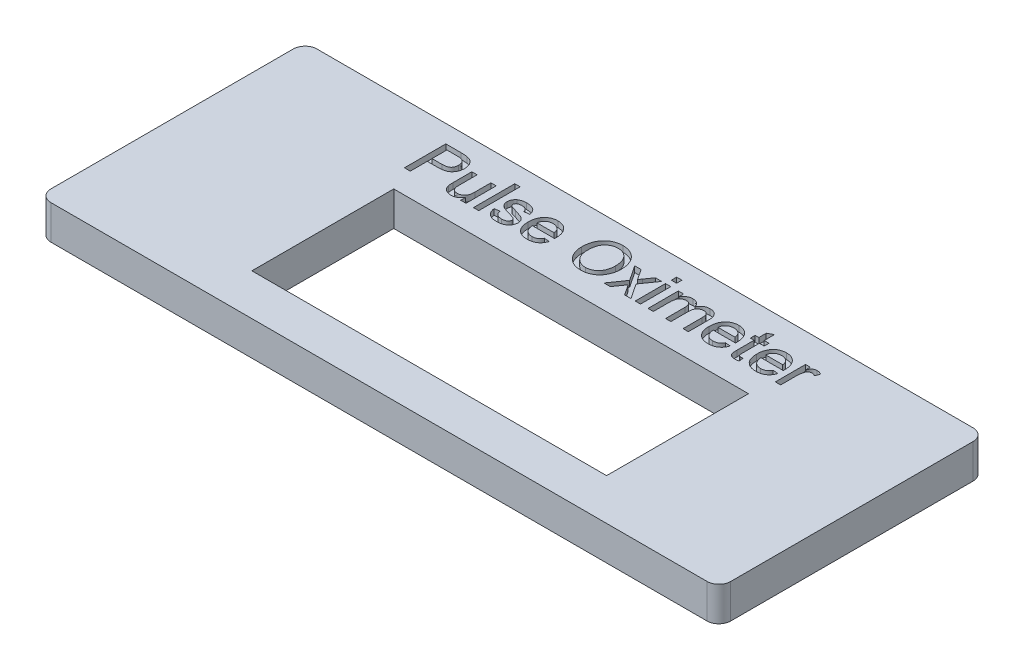
from build123d import *

# Parameters (mm, degrees)
BOSS_EXTRUDE1_DEPTH = 2.9
SKETCH2_W           = 30
SKETCH2_H           = 12
CUT_EXTRUDE1_DEPTH  = 10
SKETCH3_W           = 0.448717949
SKETCH3_H           = 3.5
SKETCH3_H_2         = 0.448717949
SKETCH3_H_3         = 2.557692308
CUT_EXTRUDE2_DEPTH  = 0.5


with BuildPart() as part:
    # Sketch1 → Boss-Extrude1 (new body)
    with BuildSketch(Plane(origin=(0, 0, 0), x_dir=(1, 0, 0), z_dir=(0, 1, 0))):
        with BuildLine():
            Line((1, 0), (56.5, 0))
            ThreePointArc((56.5, 0), (57.207106781, 0.292893219), (57.5, 1))
            Line((57.5, 1), (57.5, 21.5))
            ThreePointArc((57.5, 21.5), (57.207106781, 22.207106781), (56.5, 22.5))
            Line((56.5, 22.5), (1, 22.5))
            ThreePointArc((1, 22.5), (0.292893219, 22.207106781), (0, 21.5))
            Line((0, 21.5), (0, 1))
            ThreePointArc((0, 1), (0.292893219, 0.292893219), (1, 0))
        make_face()
    extrude(amount=BOSS_EXTRUDE1_DEPTH)

    # Sketch2 → Cut-Extrude1 (cut)
    with BuildSketch(Plane(origin=(0, 3, 0), x_dir=(1, 0, 0), z_dir=(0, 1, 0))):
        with Locations((29.5, 9.5)):
            Rectangle(SKETCH2_W, SKETCH2_H)
    extrude(amount=-CUT_EXTRUDE1_DEPTH, mode=Mode.SUBTRACT)

    # Sketch3 → Cut-Extrude2 (cut)
    # profile 1 of 14: a face of its own
    with BuildSketch(Plane(origin=(0, 2.9, 0), x_dir=(1, 0, 0), z_dir=(0, 1, 0))):
        with BuildLine():
            Line((13.403846154, 17.5), (13.403846154, 21))
            Line((13.403846154, 21), (14.689703526, 21))
            add(Edge.make_bspline(
                [(14.689703526, 21), (14.743001277, 20.999696358), (14.843094705, 20.999126118), (14.98287389, 20.992447869), (15.102904547, 20.98418577), (15.175403546, 20.972422689), (15.208533654, 20.967047276)],
                knots=[0, 0, 0, 0, 1.22865052, 2.30741144, 3.226532197, 4, 4, 4, 4], degree=3))
            add(Edge.make_bspline(
                [(15.208533654, 20.967047276), (15.248944388, 20.95927014), (15.327271654, 20.944195882), (15.438170922, 20.907855117), (15.53920658, 20.862631809), (15.630220729, 20.806288234), (15.712725393, 20.740098315), (15.785544788, 20.660787255), (15.850093685, 20.570125929), (15.904979966, 20.468185274), (15.950664384, 20.358497174), (15.982661929, 20.241641393), (16.003156415, 20.119648142), (16.005313595, 20.03627514), (16.006410256, 19.993890224)],
                knots=[0, 0, 0, 0, 1.070909925, 2.075721949, 3.031861647, 3.947440733, 4.85625699, 5.777986723, 6.742441087, 7.747548058, 8.78749499, 9.830146138, 10.896896232, 12, 12, 12, 12], degree=3))
            add(Edge.make_bspline(
                [(16.006410256, 19.993890224), (16.005637394, 19.957625706), (16.004116745, 19.886273281), (15.991059172, 19.78144627), (15.970464558, 19.680598423), (15.939744897, 19.584419858), (15.902189287, 19.491786153), (15.85486054, 19.404259598), (15.799593916, 19.320651655), (15.736185948, 19.241189828), (15.661537159, 19.167486581), (15.571725489, 19.104963865), (15.468482516, 19.05246236), (15.35178416, 19.010041711), (15.221913709, 18.976663496), (15.078445638, 18.952207753), (14.921100468, 18.938706148), (14.811724016, 18.936857648), (14.754907853, 18.935897436)],
                knots=[0, 0, 0, 0, 0.928769099, 1.82740408, 2.702266355, 3.562020322, 4.410419678, 5.259600434, 6.10654066, 6.975254961, 7.860221694, 8.783881459, 9.766664779, 10.81996744, 11.958551584, 13.197863772, 14.544415867, 16, 16, 16, 16], degree=3))
            Line((14.754907853, 18.935897436), (13.897435897, 18.935897436))
            Line((13.897435897, 18.935897436), (13.897435897, 17.5))
            Line((13.897435897, 17.5), (13.403846154, 17.5))
        make_face()
        with BuildLine():
            Line((13.897435897, 19.33974359), (14.741586538, 19.33974359))
            add(Edge.make_bspline(
                [(14.741586538, 19.33974359), (14.775254583, 19.340306532), (14.840112951, 19.341390989), (14.933830335, 19.348958916), (15.019839768, 19.362058648), (15.098379832, 19.38032894), (15.169550536, 19.403038388), (15.233224539, 19.43175959), (15.289073495, 19.466212303), (15.337467473, 19.506045452), (15.379008241, 19.550668296), (15.41500233, 19.599349357), (15.445584853, 19.652436515), (15.469557937, 19.710151882), (15.489866445, 19.771372782), (15.50254262, 19.837367716), (15.511356324, 19.907179661), (15.512325607, 19.95529869), (15.512820513, 19.979867788)],
                knots=[0, 0, 0, 0, 1.403696362, 2.704090955, 3.91683431, 5.027708188, 6.063065288, 7.026749679, 7.932587242, 8.790956304, 9.632005367, 10.468072405, 11.310475089, 12.179234342, 13.069796908, 13.994719932, 14.976123913, 16, 16, 16, 16], degree=3))
            add(Edge.make_bspline(
                [(15.512820513, 19.979867788), (15.511774956, 20.0154969), (15.509749033, 20.084533678), (15.489337353, 20.183875476), (15.45733615, 20.275669059), (15.411519844, 20.358176484), (15.356068788, 20.430557472), (15.290887247, 20.489777034), (15.218064959, 20.537120892), (15.163692375, 20.555866751), (15.136318109, 20.565304487)],
                knots=[0, 0, 0, 0, 1.143156811, 2.215038775, 3.243253804, 4.254666983, 5.233799895, 6.158487526, 7.072877374, 8, 8, 8, 8], degree=3))
            add(Edge.make_bspline(
                [(15.136318109, 20.565304487), (15.126292775, 20.567755903), (15.104507036, 20.573082997), (15.06841913, 20.57912933), (15.026595148, 20.58485467), (14.97883122, 20.588653166), (14.925562939, 20.592425557), (14.86662746, 20.594164535), (14.801890527, 20.595666516), (14.756778709, 20.59598644), (14.733173077, 20.596153846)],
                knots=[0, 0, 0, 0, 0.611063981, 1.327884044, 2.165719042, 3.110592661, 4.16481496, 5.328235826, 6.601947678, 8, 8, 8, 8], degree=3))
            Line((14.733173077, 20.596153846), (13.897435897, 20.596153846))
            Line((13.897435897, 20.596153846), (13.897435897, 19.33974359))
        make_face(mode=Mode.SUBTRACT)
    # profile 2 of 14: a face of its own
    with BuildSketch(Plane(origin=(0, 2.9, 0), x_dir=(1, 0, 0), z_dir=(0, 1, 0))):
        with BuildLine():
            Line((18.16025641, 17.5), (18.16025641, 17.91786859))
            add(Edge.make_bspline(
                [(18.16025641, 17.91786859), (18.136017146, 17.881090173), (18.089052595, 17.80983051), (18.007768589, 17.714783431), (17.919471752, 17.63491887), (17.825037324, 17.5688227), (17.723431379, 17.517760358), (17.615627982, 17.481328502), (17.501206007, 17.458728235), (17.422782167, 17.456345591), (17.38271234, 17.455128205)],
                knots=[0, 0, 0, 0, 1.113242977, 2.156953118, 3.15292751, 4.11701515, 5.063327705, 6.018459424, 6.987552904, 8, 8, 8, 8], degree=3))
            add(Edge.make_bspline(
                [(17.38271234, 17.455128205), (17.347124292, 17.456222973), (17.276748275, 17.458387898), (17.17313023, 17.475140504), (17.072795291, 17.501507471), (16.978178305, 17.539337118), (16.89078981, 17.583985161), (16.8147036, 17.636120379), (16.749761108, 17.693062687), (16.69660311, 17.756770902), (16.65468455, 17.82778109), (16.618703827, 17.904448391), (16.589599232, 17.988569662), (16.576736405, 18.04788083), (16.570112179, 18.078425481)],
                knots=[0, 0, 0, 0, 1.14139906, 2.257137587, 3.359439405, 4.4637035, 5.520213212, 6.501958096, 7.415523094, 8.283477709, 9.15156189, 10.053979392, 10.997819096, 12, 12, 12, 12], degree=3))
            add(Edge.make_bspline(
                [(16.570112179, 18.078425481), (16.566019873, 18.102686921), (16.5568536, 18.157029624), (16.550430842, 18.248714581), (16.545238719, 18.358576786), (16.545000147, 18.438090661), (16.544871795, 18.480869391)],
                knots=[0, 0, 0, 0, 0.730903206, 1.637135144, 2.728770821, 4, 4, 4, 4], degree=3))
            Line((16.544871795, 18.480869391), (16.544871795, 20.057692308))
            Line((16.544871795, 20.057692308), (16.993589744, 20.057692308))
            Line((16.993589744, 20.057692308), (16.993589744, 18.666666667))
            add(Edge.make_bspline(
                [(16.993589744, 18.666666667), (16.993854573, 18.640024534), (16.994361002, 18.58907711), (16.994597948, 18.515909885), (16.99683004, 18.449762994), (16.999748754, 18.390176305), (17.002637185, 18.337494367), (17.008215492, 18.291563186), (17.012227634, 18.252303265), (17.017251746, 18.228670988), (17.01953125, 18.217948718)],
                knots=[0, 0, 0, 0, 1.42061576, 2.716626151, 3.901017187, 4.948932519, 5.898020561, 6.712672935, 7.41592301, 8, 8, 8, 8], degree=3))
            add(Edge.make_bspline(
                [(17.01953125, 18.217948718), (17.02698062, 18.191177991), (17.041509773, 18.138964718), (17.079249325, 18.067888249), (17.126544164, 18.005045265), (17.185193448, 17.952002054), (17.254033295, 17.910754025), (17.330383876, 17.880188237), (17.41464885, 17.862641193), (17.473075651, 17.860224658), (17.503305288, 17.858974359)],
                knots=[0, 0, 0, 0, 1.016366968, 1.98230867, 2.930175142, 3.88886636, 4.861853572, 5.858076567, 6.891783063, 8, 8, 8, 8], degree=3))
            add(Edge.make_bspline(
                [(17.503305288, 17.858974359), (17.534236655, 17.860250889), (17.595932841, 17.862797076), (17.686922602, 17.881401714), (17.774641547, 17.912876371), (17.858139073, 17.955050297), (17.934429783, 18.008022801), (18.000819354, 18.070403233), (18.052915955, 18.143615443), (18.087597704, 18.210755476), (18.108488349, 18.270050991), (18.122600297, 18.319441573), (18.134312784, 18.373560054), (18.144342383, 18.432476205), (18.150698679, 18.496460762), (18.156817432, 18.564899578), (18.15908928, 18.63814144), (18.159859086, 18.688401811), (18.16025641, 18.714342949)],
                knots=[0, 0, 0, 0, 1.205933618, 2.405374018, 3.604641247, 4.831609779, 6.042767781, 7.216052998, 8.364649776, 9.530476467, 10.150343034, 10.813903158, 11.532636353, 12.30883207, 13.143262752, 14.039474568, 14.988104165, 16, 16, 16, 16], degree=3))
            Line((18.16025641, 18.714342949), (18.16025641, 20.057692308))
            Line((18.16025641, 20.057692308), (18.608974359, 20.057692308))
            Line((18.608974359, 20.057692308), (18.608974359, 17.5))
            Line((18.608974359, 17.5), (18.16025641, 17.5))
        make_face()
    # profile 3 of 14: a face of its own
    with BuildSketch(Plane(origin=(0, 2.9, 0), x_dir=(1, 0, 0), z_dir=(0, 1, 0))):
        with Locations((19.461538462, 19.25)):
            Rectangle(SKETCH3_W, SKETCH3_H)
    # profile 4 of 14: a face of its own
    with BuildSketch(Plane(origin=(0, 2.9, 0), x_dir=(1, 0, 0), z_dir=(0, 1, 0))):
        with BuildLine():
            Line((20.179487179, 18.307692308), (20.628205128, 18.352564103))
            add(Edge.make_bspline(
                [(20.628205128, 18.352564103), (20.635058921, 18.314590177), (20.648185134, 18.241863469), (20.688499666, 18.141635466), (20.74289204, 18.054951113), (20.801479863, 17.994566819), (20.855967208, 17.955663093), (20.900281386, 17.929246416), (20.948995406, 17.907913494), (21.000918854, 17.889457753), (21.056793913, 17.875472937), (21.116595772, 17.86575554), (21.180353983, 17.860306353), (21.224148554, 17.859425713), (21.246594551, 17.858974359)],
                knots=[0, 0, 0, 0, 1.576426584, 3.019132651, 4.39139761, 5.744583744, 6.429748217, 7.128801231, 7.852561526, 8.603024018, 9.382742032, 10.206978913, 11.081024327, 12, 12, 12, 12], degree=3))
            add(Edge.make_bspline(
                [(21.246594551, 17.858974359), (21.269046432, 17.859090719), (21.312625358, 17.859316574), (21.375551445, 17.865397146), (21.434156766, 17.873480416), (21.488172797, 17.885165299), (21.537486948, 17.90089548), (21.582980088, 17.918721833), (21.623475136, 17.941263872), (21.670421489, 17.974334229), (21.71882541, 18.021170879), (21.763020001, 18.083297227), (21.790168997, 18.151591474), (21.79329877, 18.199019313), (21.794871795, 18.222856571)],
                knots=[0, 0, 0, 0, 1.101207713, 2.137435615, 3.099211963, 4.003546554, 4.845050796, 5.637285753, 6.396976949, 7.112904354, 8.451176697, 9.67915534, 10.8335422, 12, 12, 12, 12], degree=3))
            add(Edge.make_bspline(
                [(21.794871795, 18.222856571), (21.794618507, 18.233665971), (21.794121343, 18.254883085), (21.78572288, 18.285284481), (21.77379066, 18.314018646), (21.756573071, 18.340905058), (21.73476031, 18.366049718), (21.708175244, 18.389655423), (21.676765523, 18.411162133), (21.653383555, 18.423384674), (21.641326122, 18.4296875)],
                knots=[0, 0, 0, 0, 0.948511305, 1.861774925, 2.756066261, 3.680846901, 4.658374041, 5.678500434, 6.80286706, 8, 8, 8, 8], degree=3))
            add(Edge.make_bspline(
                [(21.641326122, 18.4296875), (21.631324456, 18.434243588), (21.609469551, 18.444199215), (21.572702768, 18.457737109), (21.530040347, 18.473723947), (21.480286044, 18.48831714), (21.424544682, 18.505491994), (21.362334029, 18.523983055), (21.293075239, 18.541535607), (21.24494752, 18.554213098), (21.219951923, 18.560797276)],
                knots=[0, 0, 0, 0, 0.596822396, 1.30413245, 2.127382897, 3.071041962, 4.119245502, 5.296370109, 6.595843667, 8, 8, 8, 8], degree=3))
            add(Edge.make_bspline(
                [(21.219951923, 18.560797276), (21.185812776, 18.570786271), (21.120026924, 18.590034982), (21.02537173, 18.618786236), (20.937920151, 18.646234048), (20.857615126, 18.672501358), (20.78482847, 18.698615852), (20.719197411, 18.722940788), (20.661167972, 18.746996745), (20.593860248, 18.775715787), (20.519793784, 18.816123756), (20.441442102, 18.873140078), (20.375135778, 18.939685161), (20.32013027, 19.013616454), (20.276953313, 19.093927662), (20.247065125, 19.179407762), (20.227957811, 19.268792192), (20.225569726, 19.329830835), (20.224358974, 19.360777244)],
                knots=[0, 0, 0, 0, 1.22605552, 2.362598816, 3.409724438, 4.385374865, 5.274589806, 6.075051486, 6.797583358, 7.439654886, 8.596878446, 9.697305961, 10.768176168, 11.821850251, 12.863383541, 13.897821176, 14.934201653, 16, 16, 16, 16], degree=3))
            add(Edge.make_bspline(
                [(20.224358974, 19.360777244), (20.22532937, 19.388882567), (20.22725004, 19.444510438), (20.241734667, 19.526158023), (20.264800572, 19.604927941), (20.298105514, 19.679759045), (20.338904729, 19.750371308), (20.388194302, 19.81435767), (20.442408695, 19.873592521), (20.48444854, 19.906561026), (20.505508814, 19.923076923)],
                knots=[0, 0, 0, 0, 1.034021226, 2.046601578, 3.042752055, 4.048071569, 5.054273975, 6.036661087, 7.016446045, 8, 8, 8, 8], degree=3))
            add(Edge.make_bspline(
                [(20.505508814, 19.923076923), (20.523061644, 19.935322972), (20.559838426, 19.960980958), (20.621993802, 19.994555173), (20.693323636, 20.024406287), (20.772305222, 20.051150743), (20.857061041, 20.074684656), (20.946072721, 20.090215459), (21.037886796, 20.100522884), (21.100031072, 20.10187633), (21.131610577, 20.102564103)],
                knots=[0, 0, 0, 0, 0.776203524, 1.626305774, 2.557252601, 3.57906176, 4.650888526, 5.745456612, 6.854321437, 8, 8, 8, 8], degree=3))
            add(Edge.make_bspline(
                [(21.131610577, 20.102564103), (21.178630682, 20.101484033), (21.269922638, 20.099387021), (21.402381981, 20.08329884), (21.525859682, 20.055910991), (21.639700508, 20.018577246), (21.742081361, 19.971898318), (21.83175554, 19.917554432), (21.906221024, 19.853762639), (21.967643959, 19.781892621), (22.016893446, 19.699439786), (22.05630991, 19.605588312), (22.088001223, 19.499502492), (22.101776118, 19.424046068), (22.108974359, 19.384615385)],
                knots=[0, 0, 0, 0, 1.253394935, 2.433530808, 3.550681177, 4.620594829, 5.621516506, 6.544862206, 7.406547904, 8.22431151, 9.054607538, 9.956211395, 10.931993099, 12, 12, 12, 12], degree=3))
            Line((22.108974359, 19.384615385), (21.66025641, 19.33974359))
            add(Edge.make_bspline(
                [(21.66025641, 19.33974359), (21.654918088, 19.36665571), (21.64455976, 19.418875225), (21.613198739, 19.491161225), (21.568666099, 19.553389357), (21.512111384, 19.606210839), (21.443309613, 19.648908896), (21.361071344, 19.677841566), (21.26705747, 19.696392842), (21.199952366, 19.697915139), (21.164563301, 19.698717949)],
                knots=[0, 0, 0, 0, 0.971549383, 1.88516682, 2.771115596, 3.668786025, 4.614654303, 5.622170142, 6.746009326, 8, 8, 8, 8], degree=3))
            add(Edge.make_bspline(
                [(21.164563301, 19.698717949), (21.143289877, 19.69846492), (21.102334167, 19.697977788), (21.043096965, 19.693818491), (20.988639281, 19.686631607), (20.938483658, 19.67820423), (20.893684813, 19.665162976), (20.85294358, 19.650843045), (20.81739499, 19.632507018), (20.777078151, 19.606242193), (20.73696251, 19.568213196), (20.699472933, 19.518827641), (20.677112889, 19.463723799), (20.674421741, 19.425467535), (20.673076923, 19.40635016)],
                knots=[0, 0, 0, 0, 1.202032812, 2.314159929, 3.352655878, 4.305866621, 5.183839704, 5.986040797, 6.742017283, 7.437935182, 8.699432998, 9.843179159, 10.922196019, 12, 12, 12, 12], degree=3))
            add(Edge.make_bspline(
                [(20.673076923, 19.40635016), (20.673528168, 19.394130541), (20.67441804, 19.370033017), (20.684161176, 19.335250911), (20.698953574, 19.302256745), (20.712923177, 19.282511966), (20.720052083, 19.272435897)],
                knots=[0, 0, 0, 0, 1.012137305, 1.99597066, 2.977312565, 4, 4, 4, 4], degree=3))
            add(Edge.make_bspline(
                [(20.720052083, 19.272435897), (20.728599401, 19.26227856), (20.746385453, 19.241142231), (20.781217873, 19.214846113), (20.821749283, 19.190135113), (20.852140396, 19.17694862), (20.867988782, 19.170072115)],
                knots=[0, 0, 0, 0, 0.873299099, 1.81724178, 2.861733162, 4, 4, 4, 4], degree=3))
            add(Edge.make_bspline(
                [(20.867988782, 19.170072115), (20.874052507, 19.167930482), (20.888201865, 19.162933102), (20.913310084, 19.155286235), (20.94503213, 19.145499395), (20.984140082, 19.134309107), (21.029882796, 19.120998624), (21.083006637, 19.106295055), (21.142773705, 19.089478784), (21.185120248, 19.077957942), (21.207331731, 19.071915064)],
                knots=[0, 0, 0, 0, 0.436802817, 1.019254657, 1.782618184, 2.69198815, 3.782349451, 5.018834001, 6.436327698, 8, 8, 8, 8], degree=3))
            add(Edge.make_bspline(
                [(21.207331731, 19.071915064), (21.240303582, 19.061927617), (21.30397816, 19.04264006), (21.396203361, 19.013602539), (21.482065808, 18.986544292), (21.561317696, 18.960660556), (21.633905728, 18.935834029), (21.70017923, 18.913070795), (21.759944139, 18.891128553), (21.830045599, 18.864860398), (21.909687782, 18.829464547), (21.994187864, 18.775793356), (22.068256916, 18.713476183), (22.131109258, 18.642462278), (22.182178463, 18.562158243), (22.217551517, 18.471946482), (22.24018188, 18.37307076), (22.2424286, 18.304083376), (22.243589744, 18.268429487)],
                knots=[0, 0, 0, 0, 1.155996739, 2.232437775, 3.244329082, 4.176768736, 5.029854173, 5.818511279, 6.528027969, 7.165934889, 8.330913826, 9.444808892, 10.513164249, 11.568838208, 12.615385132, 13.688622127, 14.805439433, 16, 16, 16, 16], degree=3))
            add(Edge.make_bspline(
                [(22.243589744, 18.268429487), (22.242135292, 18.23254155), (22.239233825, 18.160949169), (22.214848464, 18.055721002), (22.176811309, 17.953320989), (22.122818841, 17.855874983), (22.054878113, 17.764783702), (21.971916458, 17.684346272), (21.875145628, 17.614977844), (21.765879477, 17.55767444), (21.646615604, 17.510802312), (21.518204613, 17.479767039), (21.382648456, 17.458003239), (21.289455338, 17.456102487), (21.241686699, 17.455128205)],
                knots=[0, 0, 0, 0, 0.894809563, 1.785044015, 2.682170314, 3.614214614, 4.555721535, 5.508634546, 6.486485836, 7.51727745, 8.581064401, 9.676123613, 10.808834633, 12, 12, 12, 12], degree=3))
            add(Edge.make_bspline(
                [(21.241686699, 17.455128205), (21.202403544, 17.455820532), (21.12627999, 17.457162134), (21.015677827, 17.466935317), (20.912266088, 17.48353259), (20.816117924, 17.507275091), (20.727180479, 17.53747188), (20.645200865, 17.573816686), (20.570357549, 17.617465056), (20.502690986, 17.668161656), (20.441760396, 17.725941328), (20.386315786, 17.789619704), (20.336982264, 17.86013902), (20.294385892, 17.937325474), (20.256193662, 18.020362919), (20.224116415, 18.110203791), (20.198110097, 18.206620958), (20.185792871, 18.273469704), (20.179487179, 18.307692308)],
                knots=[0, 0, 0, 0, 1.244406412, 2.411431524, 3.514215425, 4.559320282, 5.545040859, 6.48623969, 7.395443761, 8.283912081, 9.158607275, 10.050831307, 10.954592804, 11.879399228, 12.840196462, 13.8472361, 14.897912238, 16, 16, 16, 16], degree=3))
        make_face()
    # profile 5 of 14: a face of its own
    with BuildSketch(Plane(origin=(0, 2.9, 0), x_dir=(1, 0, 0), z_dir=(0, 1, 0))):
        with BuildLine():
            Line((24.482271635, 18.262820513), (24.921875, 18.217948718))
            add(Edge.make_bspline(
                [(24.921875, 18.217948718), (24.912861389, 18.188296348), (24.895129853, 18.129964337), (24.859152471, 18.047231904), (24.819618188, 17.968632168), (24.772909238, 17.895877903), (24.721658168, 17.82742068), (24.664849517, 17.76380654), (24.601241518, 17.706640566), (24.533198498, 17.653535451), (24.459588298, 17.606865004), (24.381186873, 17.565660563), (24.297707145, 17.531654596), (24.209387365, 17.503325724), (24.116025652, 17.481719425), (24.017795217, 17.466792807), (23.914825663, 17.456217868), (23.844512969, 17.455497322), (23.80849359, 17.455128205)],
                knots=[0, 0, 0, 0, 1.017198368, 2.001028156, 2.958938375, 3.904526299, 4.836491671, 5.766019286, 6.700699831, 7.641977538, 8.598163567, 9.559604839, 10.547559217, 11.555094156, 12.60347703, 13.691418688, 14.817373327, 16, 16, 16, 16], degree=3))
            add(Edge.make_bspline(
                [(23.80849359, 17.455128205), (23.763335947, 17.456189389), (23.675292547, 17.458258369), (23.546715886, 17.474856256), (23.425264642, 17.501112267), (23.310674321, 17.538312422), (23.203679264, 17.586791035), (23.104007765, 17.64641453), (23.011039856, 17.715805403), (22.926113806, 17.79618568), (22.849276109, 17.885770716), (22.783653575, 17.985381426), (22.726740273, 18.092630574), (22.681475037, 18.209260301), (22.645697117, 18.33410287), (22.620872903, 18.467689578), (22.604990374, 18.609490425), (22.603386847, 18.707053398), (22.602564103, 18.757111378)],
                knots=[0, 0, 0, 0, 1.077616366, 2.10101772, 3.089143248, 4.040031729, 4.971276009, 5.886882173, 6.807369977, 7.734796568, 8.672701003, 9.618074947, 10.576315496, 11.565652878, 12.598619221, 13.67195277, 14.805516698, 16, 16, 16, 16], degree=3))
            add(Edge.make_bspline(
                [(22.602564103, 18.757111378), (22.60339482, 18.809034007), (22.60500782, 18.909851923), (22.620686713, 19.056642617), (22.646616364, 19.19446477), (22.681802152, 19.32381841), (22.728425649, 19.44407866), (22.785314767, 19.555201677), (22.852117747, 19.657789114), (22.929479882, 19.750338761), (23.015081609, 19.832637973), (23.106203152, 19.905820119), (23.204756903, 19.966214914), (23.308728356, 20.016358836), (23.419119595, 20.054884434), (23.535250597, 20.083256642), (23.658005611, 20.099266301), (23.741841948, 20.101449293), (23.784655449, 20.102564103)],
                knots=[0, 0, 0, 0, 1.232307979, 2.392766439, 3.499416159, 4.558769794, 5.570548426, 6.555643267, 7.517416609, 8.470735273, 9.412423306, 10.33263532, 11.239503873, 12.150233765, 13.067967044, 14.009932887, 14.983713455, 16, 16, 16, 16], degree=3))
            add(Edge.make_bspline(
                [(23.784655449, 20.102564103), (23.826079138, 20.101498886), (23.907146506, 20.099414226), (24.02591294, 20.082682538), (24.13908299, 20.056536454), (24.246419058, 20.018560696), (24.347380929, 19.968711187), (24.443058997, 19.909214649), (24.532784888, 19.838349148), (24.61598315, 19.757080281), (24.691789149, 19.666320509), (24.757362477, 19.565717847), (24.812886773, 19.456686925), (24.857897524, 19.338394186), (24.892545147, 19.211521452), (24.917646429, 19.075985658), (24.933476485, 18.931832885), (24.935075459, 18.832641473), (24.935897436, 18.781650641)],
                knots=[0, 0, 0, 0, 1.005323219, 1.967446859, 2.906060863, 3.821317632, 4.724696067, 5.63467896, 6.55185077, 7.494776645, 8.453732942, 9.416859909, 10.403972786, 11.418730779, 12.484189468, 13.592581733, 14.76243057, 16, 16, 16, 16], degree=3))
            add(Edge.make_bspline(
                [(24.935897436, 18.781650641), (24.935683908, 18.765758188), (24.935168896, 18.72742689), (24.934301713, 18.689101849), (24.933794071, 18.666666667)],
                knots=[0, 0, 0, 0, 0.829215456, 2, 2, 2, 2], degree=3))
            Line((24.933794071, 18.666666667), (23.051282051, 18.666666667))
            add(Edge.make_bspline(
                [(23.051282051, 18.666666667), (23.053879786, 18.635065356), (23.058961992, 18.573240559), (23.07378245, 18.483729659), (23.093783016, 18.399607765), (23.120706135, 18.321615578), (23.152511303, 18.24887961), (23.191817138, 18.182596256), (23.23560718, 18.121293352), (23.285920849, 18.066465499), (23.340219056, 18.017696575), (23.398324651, 17.974915241), (23.460134589, 17.939431508), (23.52475469, 17.909601109), (23.592788813, 17.887153696), (23.663926477, 17.871089663), (23.738564704, 17.861039504), (23.789531468, 17.859671508), (23.815504808, 17.858974359)],
                knots=[0, 0, 0, 0, 1.224729154, 2.396059788, 3.502114335, 4.561587772, 5.580251543, 6.563724943, 7.533714888, 8.486186356, 9.43260269, 10.350144711, 11.268619442, 12.181885516, 13.095687177, 14.031096784, 14.996620783, 16, 16, 16, 16], degree=3))
            add(Edge.make_bspline(
                [(23.815504808, 17.858974359), (23.853427727, 17.86024408), (23.926894004, 17.862703851), (24.032899184, 17.879960912), (24.130069597, 17.910388575), (24.219088109, 17.952626154), (24.299807002, 18.008615494), (24.370241012, 18.080280814), (24.432862067, 18.165217081), (24.46543215, 18.229555873), (24.482271635, 18.262820513)],
                knots=[0, 0, 0, 0, 1.096312125, 2.123833578, 3.094060441, 4.030938787, 4.962563683, 5.918139224, 6.923629937, 8, 8, 8, 8], degree=3))
        make_face()
        with BuildLine():
            Line((23.051282051, 19.070512821), (24.487179487, 19.070512821))
            add(Edge.make_bspline(
                [(24.487179487, 19.070512821), (24.484354924, 19.092745256), (24.478832284, 19.136214531), (24.467208016, 19.199087406), (24.45170494, 19.257665577), (24.433033859, 19.311729025), (24.410265745, 19.361381249), (24.384541483, 19.406698434), (24.355797851, 19.44816454), (24.333458263, 19.472262917), (24.322415865, 19.484174679)],
                knots=[0, 0, 0, 0, 1.185316253, 2.317552585, 3.379013743, 4.387694847, 5.339152611, 6.263729899, 7.141766409, 8, 8, 8, 8], degree=3))
            add(Edge.make_bspline(
                [(24.322415865, 19.484174679), (24.304772631, 19.501395038), (24.269924227, 19.535408189), (24.211822506, 19.579253316), (24.149380315, 19.615613554), (24.083811605, 19.646985753), (24.013649782, 19.66971409), (23.940299584, 19.686884029), (23.862739962, 19.696610504), (23.809688068, 19.698004779), (23.782552083, 19.698717949)],
                knots=[0, 0, 0, 0, 0.989486767, 1.954405495, 2.91383024, 3.888017634, 4.867526279, 5.869356945, 6.910178459, 8, 8, 8, 8], degree=3))
            add(Edge.make_bspline(
                [(23.782552083, 19.698717949), (23.757992058, 19.698147613), (23.709917503, 19.697031219), (23.639093103, 19.689175169), (23.571212429, 19.676151853), (23.506395811, 19.656828994), (23.444406493, 19.633344349), (23.385680342, 19.603323722), (23.329806284, 19.568440798), (23.277006866, 19.528539475), (23.229242836, 19.483822693), (23.185562007, 19.436189371), (23.149398657, 19.383543626), (23.117334387, 19.328338405), (23.092227847, 19.268850828), (23.072462872, 19.20595722), (23.058393294, 19.139484249), (23.053673587, 19.093708148), (23.051282051, 19.070512821)],
                knots=[0, 0, 0, 0, 1.10270868, 2.158476208, 3.195774995, 4.201977093, 5.192014471, 6.168217026, 7.158254405, 8.146844603, 9.134487423, 10.093158795, 11.042305272, 11.996428104, 12.955501471, 13.934632866, 14.95345241, 16, 16, 16, 16], degree=3))
        make_face(mode=Mode.SUBTRACT)
    # profile 6 of 14: a face of its own
    with BuildSketch(Plane(origin=(0, 2.9, 0), x_dir=(1, 0, 0), z_dir=(0, 1, 0))):
        with BuildLine():
            add(Edge.make_bspline(
                [(26.685897436, 19.203725962), (26.687113901, 19.273897945), (26.689484122, 19.410624496), (26.711630374, 19.609715971), (26.747590203, 19.797035007), (26.79899796, 19.97256701), (26.86415744, 20.136587039), (26.943371235, 20.289466493), (27.039022044, 20.429474887), (27.147227484, 20.55794501), (27.268087989, 20.671522014), (27.396770076, 20.772394667), (27.53488058, 20.856534385), (27.681143465, 20.926006053), (27.83618014, 20.979344388), (27.999555309, 21.016686076), (28.171094242, 21.040775094), (28.288345118, 21.043486393), (28.348257212, 21.044871795)],
                knots=[0, 0, 0, 0, 1.203621547, 2.345195544, 3.432004029, 4.472479546, 5.478447225, 6.455936844, 7.420185704, 8.381829745, 9.332027588, 10.260832629, 11.182364398, 12.100723901, 13.034044877, 13.989196293, 14.972532542, 16, 16, 16, 16], degree=3))
            add(Edge.make_bspline(
                [(28.348257212, 21.044871795), (28.387773354, 21.044181769), (28.466245266, 21.042811501), (28.582258983, 21.032385597), (28.695291556, 21.013777164), (28.805231676, 20.988839777), (28.912378601, 20.95612301), (29.016796316, 20.917501862), (29.11757076, 20.869644822), (29.215372361, 20.816064103), (29.309046642, 20.756131752), (29.397081496, 20.689924605), (29.479266053, 20.617943385), (29.556704274, 20.541371266), (29.626812155, 20.457624046), (29.692486029, 20.369252808), (29.751838721, 20.274690589), (29.805080826, 20.174712164), (29.852684679, 20.070861683), (29.893371363, 19.962708728), (29.928308277, 19.851550668), (29.957553421, 19.736729567), (29.978537601, 19.618284679), (29.99524753, 19.496726371), (30.004042428, 19.371657349), (30.005614322, 19.287170996), (30.006410256, 19.244391026)],
                knots=[0, 0, 0, 0, 1.034375294, 2.054082248, 3.045783978, 4.031219655, 5.002789406, 5.976610191, 6.94273282, 7.920236376, 8.894345378, 9.851183672, 10.800797181, 11.752517031, 12.698794154, 13.65688337, 14.632873302, 15.61821402, 16.620222298, 17.621258913, 18.640965868, 19.669244166, 20.720417492, 21.788124603, 22.880008887, 24, 24, 24, 24], degree=3))
            add(Edge.make_bspline(
                [(30.006410256, 19.244391026), (30.005681007, 19.200905612), (30.00424025, 19.11499268), (29.994491495, 18.988072994), (29.977349796, 18.864796909), (29.95461425, 18.744796837), (29.924149313, 18.628322595), (29.887946417, 18.515040243), (29.844156969, 18.405624514), (29.794701649, 18.299811692), (29.738742975, 18.199057073), (29.677016761, 18.104065179), (29.609479278, 18.015724584), (29.537156411, 17.932951576), (29.458359231, 17.857226289), (29.374058018, 17.787840638), (29.284576908, 17.724140237), (29.189615291, 17.667850291), (29.090877382, 17.618510143), (28.99031705, 17.574736542), (28.887859595, 17.537404674), (28.783154849, 17.507150905), (28.676488438, 17.484288979), (28.568160531, 17.467169728), (28.457816017, 17.457312405), (28.383565834, 17.455860013), (28.346153846, 17.455128205)],
                knots=[0, 0, 0, 0, 1.141429366, 2.255090526, 3.338676798, 4.407031443, 5.458968682, 6.496860253, 7.526652771, 8.550250826, 9.560787671, 10.54935636, 11.521089193, 12.477323897, 13.431786008, 14.386110112, 15.340986122, 16.312041, 17.28047646, 18.236612773, 19.189437236, 20.140779471, 21.09494583, 22.051062463, 23.018000708, 24, 24, 24, 24], degree=3))
            add(Edge.make_bspline(
                [(28.346153846, 17.455128205), (28.30592765, 17.455723357), (28.22624963, 17.456902203), (28.10848337, 17.468669097), (27.993646949, 17.486619905), (27.882074218, 17.512535447), (27.773917635, 17.546344103), (27.669049228, 17.587265031), (27.567100163, 17.634751335), (27.469335459, 17.690162703), (27.376087867, 17.751774188), (27.288261176, 17.819279522), (27.205903952, 17.892056584), (27.130337691, 17.971308291), (27.059115039, 18.054161738), (26.995083798, 18.143696537), (26.936152807, 18.237882132), (26.884065932, 18.337626431), (26.837013235, 18.439965412), (26.797370322, 18.544931811), (26.762531884, 18.650978702), (26.734786595, 18.758759713), (26.712676976, 18.868026218), (26.697809859, 18.978596402), (26.687072715, 19.090634939), (26.686291167, 19.16583925), (26.685897436, 19.203725962)],
                knots=[0, 0, 0, 0, 1.072727997, 2.12480551, 3.153819198, 4.171534612, 5.177148798, 6.173931848, 7.17235114, 8.174500385, 9.168706755, 10.151274001, 11.127173509, 12.097141049, 13.070188938, 14.039134204, 15.03036519, 16.031505612, 17.038625933, 18.033164522, 19.022845559, 20.014762458, 21.000193215, 21.994692725, 22.989758729, 24, 24, 24, 24], degree=3))
        make_face()
        with BuildLine():
            add(Edge.make_bspline(
                [(27.179487179, 19.198116987), (27.180243582, 19.147586828), (27.181718515, 19.049056583), (27.198592538, 18.905404726), (27.224196173, 18.769861884), (27.259488082, 18.642047554), (27.30692905, 18.523225802), (27.363650869, 18.412254867), (27.431563378, 18.309872419), (27.509168222, 18.216364863), (27.594524655, 18.132364682), (27.685736666, 18.058994992), (27.782824758, 17.997553066), (27.884712539, 17.94681964), (27.992131819, 17.907217575), (28.104760878, 17.879410003), (28.222682469, 17.862018623), (28.303090452, 17.860001756), (28.344050481, 17.858974359)],
                knots=[0, 0, 0, 0, 1.215430442, 2.370003584, 3.475209778, 4.53279855, 5.55522989, 6.548792651, 7.526809858, 8.505409025, 9.467826767, 10.404123909, 11.316848639, 12.227335424, 13.138360512, 14.065900994, 15.014765094, 16, 16, 16, 16], degree=3))
            add(Edge.make_bspline(
                [(28.344050481, 17.858974359), (28.385704784, 17.860016952), (28.467263793, 17.862058346), (28.586963211, 17.879146127), (28.700691059, 17.908237346), (28.809574581, 17.946964347), (28.911645269, 17.999316652), (29.009290265, 18.060620914), (29.099847753, 18.135532966), (29.185540664, 18.219681711), (29.262401433, 18.315332214), (29.330599185, 18.420128299), (29.385998238, 18.535641641), (29.433827843, 18.659327639), (29.468851437, 18.793524006), (29.494736019, 18.936705198), (29.510334616, 19.089331784), (29.511977229, 19.194107104), (29.512820513, 19.247896635)],
                knots=[0, 0, 0, 0, 0.976878588, 1.912725521, 2.8289017, 3.727303729, 4.617335839, 5.514666588, 6.426584173, 7.368641557, 8.327632997, 9.299405846, 10.294892156, 11.327373912, 12.405931897, 13.542618837, 14.738430195, 16, 16, 16, 16], degree=3))
            add(Edge.make_bspline(
                [(29.512820513, 19.247896635), (29.512522497, 19.282501318), (29.511937896, 19.350383183), (29.504195832, 19.450441828), (29.494209561, 19.547388078), (29.47900531, 19.641096834), (29.458051922, 19.73118003), (29.434839126, 19.818323469), (29.405812337, 19.901776198), (29.3728774, 19.981865486), (29.336023762, 20.05818017), (29.294457761, 20.130076887), (29.248662478, 20.197276118), (29.199873522, 20.261051894), (29.145389239, 20.318935829), (29.087833078, 20.373372968), (29.025897653, 20.423238629), (28.960201057, 20.468545836), (28.891675281, 20.509329463), (28.820461591, 20.544234956), (28.747694523, 20.574895046), (28.672156057, 20.598397292), (28.594889236, 20.617352198), (28.515581705, 20.631750215), (28.433939096, 20.639206178), (28.378885882, 20.640414798), (28.351061699, 20.641025641)],
                knots=[0, 0, 0, 0, 1.220438779, 2.394059227, 3.538503547, 4.658058814, 5.74010225, 6.800155734, 7.837851593, 8.854470756, 9.853724944, 10.825214244, 11.781044712, 12.72106398, 13.654479919, 14.581868691, 15.514082315, 16.456304431, 17.39516604, 18.324312202, 19.252140633, 20.177768678, 21.111585046, 22.057694709, 23.018348693, 24, 24, 24, 24], degree=3))
            add(Edge.make_bspline(
                [(28.351061699, 20.641025641), (28.311736011, 20.640244648), (28.234142046, 20.638703663), (28.119914494, 20.621573216), (28.009786748, 20.595977988), (27.903587903, 20.560194496), (27.80222626, 20.512811529), (27.705176674, 20.454702804), (27.611577687, 20.38745053), (27.522905223, 20.309416121), (27.44024309, 20.219773634), (27.37036055, 20.114087889), (27.311461637, 19.994881827), (27.262282128, 19.862457606), (27.224784202, 19.71578969), (27.198868444, 19.555509259), (27.182505763, 19.381447416), (27.180519098, 19.260789413), (27.179487179, 19.198116987)],
                knots=[0, 0, 0, 0, 0.895090134, 1.766112571, 2.624765742, 3.468151641, 4.313618154, 5.168136083, 6.041303099, 6.935189387, 7.854749729, 8.809996334, 9.809869957, 10.877771942, 12.021723904, 13.25217762, 14.572720513, 16, 16, 16, 16], degree=3))
        make_face(mode=Mode.SUBTRACT)
    # profile 7 of 14: a face of its own
    with BuildSketch(Plane(origin=(0, 2.9, 0), x_dir=(1, 0, 0), z_dir=(0, 1, 0))):
        with BuildLine():
            Line((30.275641026, 17.5), (31.173076923, 18.778846154))
            Line((31.173076923, 18.778846154), (30.320512821, 20.057692308))
            Line((30.320512821, 20.057692308), (30.858273237, 20.057692308))
            Line((30.858273237, 20.057692308), (31.272636218, 19.437199519))
            add(Edge.make_bspline(
                [(31.272636218, 19.437199519), (31.290045201, 19.410710713), (31.322976924, 19.36060313), (31.371240462, 19.291120829), (31.411580582, 19.228736507), (31.437344289, 19.19060132), (31.44931891, 19.172876603)],
                knots=[0, 0, 0, 0, 1.196313644, 2.263008139, 3.192669756, 4, 4, 4, 4], degree=3))
            add(Edge.make_bspline(
                [(31.44931891, 19.172876603), (31.478076643, 19.213767133), (31.535404827, 19.295281896), (31.592593051, 19.376894911), (31.62109375, 19.417568109)],
                knots=[0, 0, 0, 0, 1.003266858, 2, 2, 2, 2], degree=3))
            Line((31.62109375, 19.417568109), (32.070512821, 20.057692308))
            Line((32.070512821, 20.057692308), (32.607572115, 20.057692308))
            Line((32.607572115, 20.057692308), (31.71083734, 18.779547276))
            Line((31.71083734, 18.779547276), (32.564102564, 17.5))
            Line((32.564102564, 17.5), (32.026342147, 17.5))
            Line((32.026342147, 17.5), (31.528545673, 18.246694712))
            Line((31.528545673, 18.246694712), (31.434595353, 18.385516827))
            Line((31.434595353, 18.385516827), (30.813401442, 17.5))
            Line((30.813401442, 17.5), (30.275641026, 17.5))
        make_face()
    # profile 8 of 14: a face of its own
    with BuildSketch(Plane(origin=(0, 2.9, 0), x_dir=(1, 0, 0), z_dir=(0, 1, 0))):
        with Locations((33.147435898, 20.775641026)):
            Rectangle(SKETCH3_W, SKETCH3_H_2)
    # profile 9 of 14: a face of its own
    with BuildSketch(Plane(origin=(0, 2.9, 0), x_dir=(1, 0, 0), z_dir=(0, 1, 0))):
        with Locations((33.147435898, 18.778846154)):
            Rectangle(SKETCH3_W, SKETCH3_H_3)
    # profile 10 of 14: a face of its own
    with BuildSketch(Plane(origin=(0, 2.9, 0), x_dir=(1, 0, 0), z_dir=(0, 1, 0))):
        with BuildLine():
            Line((34.005608974, 17.5), (34.005608974, 20.057692308))
            Line((34.005608974, 20.057692308), (34.454326923, 20.057692308))
            Line((34.454326923, 20.057692308), (34.454326923, 19.658754006))
            add(Edge.make_bspline(
                [(34.454326923, 19.658754006), (34.474080134, 19.691107232), (34.513053154, 19.754940039), (34.585335289, 19.840226448), (34.665489811, 19.916492652), (34.754498336, 19.982769968), (34.852212898, 20.03639149), (34.957241019, 20.075226442), (35.069154772, 20.098198645), (35.145759407, 20.101087976), (35.184895833, 20.102564103)],
                knots=[0, 0, 0, 0, 1.012837134, 1.998324314, 2.98019487, 3.968118755, 4.958650973, 5.951725623, 6.953560186, 8, 8, 8, 8], degree=3))
            add(Edge.make_bspline(
                [(35.184895833, 20.102564103), (35.227553236, 20.101275753), (35.309624145, 20.098797028), (35.426524115, 20.074579624), (35.531573832, 20.035130708), (35.624495508, 19.980101527), (35.704259598, 19.910163951), (35.772876469, 19.828692445), (35.827396907, 19.733458316), (35.852256869, 19.663645469), (35.864983974, 19.627904647)],
                knots=[0, 0, 0, 0, 1.14260047, 2.198311542, 3.184080093, 4.139503782, 5.07683556, 6.015590709, 6.984077836, 8, 8, 8, 8], degree=3))
            add(Edge.make_bspline(
                [(35.864983974, 19.627904647), (35.889808982, 19.665723336), (35.937934197, 19.739037818), (36.022655781, 19.835143633), (36.110702738, 19.918467274), (36.205687022, 19.985733245), (36.306279194, 20.038461268), (36.412765165, 20.075731794), (36.524989566, 20.097973276), (36.601529243, 20.10101724), (36.640424679, 20.102564103)],
                knots=[0, 0, 0, 0, 1.138522562, 2.207114883, 3.219638414, 4.186902816, 5.129823568, 6.072192529, 7.02033929, 8, 8, 8, 8], degree=3))
            add(Edge.make_bspline(
                [(36.640424679, 20.102564103), (36.67060223, 20.101878174), (36.729485535, 20.100539769), (36.815064925, 20.090526229), (36.895496832, 20.074861616), (36.970310106, 20.051390364), (37.039962095, 20.022079105), (37.10446244, 19.986264728), (37.162841521, 19.943102267), (37.216061113, 19.893704035), (37.263172163, 19.837041854), (37.304895867, 19.773821823), (37.339186106, 19.702934401), (37.366946328, 19.625248008), (37.389756047, 19.540944339), (37.404383252, 19.449049307), (37.414789154, 19.350499696), (37.415499853, 19.282281834), (37.415865385, 19.247195513)],
                knots=[0, 0, 0, 0, 1.095882962, 2.138318376, 3.1255456, 4.06796008, 4.980856081, 5.866385201, 6.740777206, 7.611659656, 8.497473544, 9.411000816, 10.356316449, 11.349910013, 12.40416823, 13.523408539, 14.726220937, 16, 16, 16, 16], degree=3))
            Line((37.415865385, 19.247195513), (37.415865385, 17.5))
            Line((37.415865385, 17.5), (36.967147436, 17.5))
            Line((36.967147436, 17.5), (36.967147436, 19.081730769))
            add(Edge.make_bspline(
                [(36.967147436, 19.081730769), (36.966499679, 19.121227713), (36.965298814, 19.194450464), (36.959551237, 19.295592423), (36.94614936, 19.378776976), (36.929259427, 19.446834967), (36.904065818, 19.503087821), (36.871787923, 19.552068733), (36.829926621, 19.594654469), (36.781193452, 19.631374149), (36.726351453, 19.661801147), (36.666090635, 19.683722504), (36.6007614, 19.696446126), (36.555645588, 19.697946579), (36.532451923, 19.698717949)],
                knots=[0, 0, 0, 0, 1.637099343, 3.034992218, 4.192454477, 5.125064895, 5.931363659, 6.734457378, 7.542615046, 8.392902438, 9.255454751, 10.131653416, 11.039498489, 12, 12, 12, 12], degree=3))
            add(Edge.make_bspline(
                [(36.532451923, 19.698717949), (36.51138341, 19.698224335), (36.470007769, 19.697254945), (36.409542457, 19.688290645), (36.351486369, 19.675547605), (36.296757703, 19.655403293), (36.244307034, 19.63075431), (36.194444413, 19.600796725), (36.14788129, 19.564285907), (36.103684872, 19.523267888), (36.063105794, 19.476062928), (36.028631033, 19.421434289), (36.000344843, 19.360132839), (35.976121852, 19.292630068), (35.957582093, 19.218647187), (35.944271334, 19.137993274), (35.936758559, 19.050790881), (35.9356638, 18.990365682), (35.935096154, 18.959034455)],
                knots=[0, 0, 0, 0, 0.936978583, 1.840096209, 2.715540616, 3.577474171, 4.428863993, 5.292176944, 6.159677271, 7.057388756, 7.97228745, 8.921538631, 9.921836886, 10.971267826, 12.108934396, 13.31095831, 14.605698001, 16, 16, 16, 16], degree=3))
            Line((35.935096154, 18.959034455), (35.935096154, 17.5))
            Line((35.935096154, 17.5), (35.486378205, 17.5))
            Line((35.486378205, 17.5), (35.486378205, 19.131510417))
            add(Edge.make_bspline(
                [(35.486378205, 19.131510417), (35.48620876, 19.154426454), (35.48588154, 19.198680089), (35.48054397, 19.262995754), (35.473402454, 19.323043523), (35.461986561, 19.378493195), (35.448244553, 19.429534301), (35.430516785, 19.475856307), (35.410377596, 19.518385908), (35.386371288, 19.556500319), (35.359109838, 19.590461486), (35.327664012, 19.619659031), (35.292432296, 19.644503555), (35.252552063, 19.664068683), (35.208974452, 19.679406113), (35.161503306, 19.690547631), (35.110099966, 19.697819443), (35.07437864, 19.698411502), (35.055889423, 19.698717949)],
                knots=[0, 0, 0, 0, 1.345752242, 2.598810075, 3.789149697, 4.895786345, 5.921724826, 6.890687139, 7.805619527, 8.681717145, 9.530827886, 10.356528998, 11.194466742, 12.054057324, 12.95727461, 13.903003647, 14.914602983, 16, 16, 16, 16], degree=3))
            add(Edge.make_bspline(
                [(35.055889423, 19.698717949), (35.027268655, 19.697796748), (34.970590801, 19.69597249), (34.887818385, 19.67657577), (34.808230895, 19.646963408), (34.732878451, 19.605807035), (34.663568168, 19.55355086), (34.604606817, 19.488376225), (34.556122131, 19.412376638), (34.524078608, 19.34122591), (34.503779523, 19.278068392), (34.490696306, 19.224851735), (34.479564135, 19.166799753), (34.470645272, 19.103593457), (34.462620908, 19.035611296), (34.458381745, 18.962339862), (34.454258625, 18.884293364), (34.454303643, 18.830502224), (34.454326923, 18.802684295)],
                knots=[0, 0, 0, 0, 1.117976261, 2.213934112, 3.307715435, 4.433034498, 5.561469973, 6.68771744, 7.851930709, 9.075635627, 9.729167061, 10.44550689, 11.218440431, 12.040901402, 12.942650761, 13.89578902, 14.911813504, 16, 16, 16, 16], degree=3))
            Line((34.454326923, 18.802684295), (34.454326923, 17.5))
            Line((34.454326923, 17.5), (34.005608974, 17.5))
        make_face()
    # profile 11 of 14: a face of its own
    with BuildSketch(Plane(origin=(0, 2.9, 0), x_dir=(1, 0, 0), z_dir=(0, 1, 0))):
        with BuildLine():
            Line((39.783553686, 18.262820513), (40.223157051, 18.217948718))
            add(Edge.make_bspline(
                [(40.223157051, 18.217948718), (40.21414344, 18.188296348), (40.196411904, 18.129964337), (40.160434523, 18.047231904), (40.12090024, 17.968632168), (40.074191289, 17.895877903), (40.02294022, 17.82742068), (39.966131569, 17.76380654), (39.90252357, 17.706640566), (39.834480549, 17.653535451), (39.76087035, 17.606865004), (39.682468925, 17.565660563), (39.598989196, 17.531654596), (39.510669416, 17.503325724), (39.417307703, 17.481719425), (39.319077268, 17.466792807), (39.216107714, 17.456217868), (39.145795021, 17.455497322), (39.109775641, 17.455128205)],
                knots=[0, 0, 0, 0, 1.017198368, 2.001028156, 2.958938375, 3.904526299, 4.836491671, 5.766019286, 6.700699831, 7.641977538, 8.598163567, 9.559604839, 10.547559217, 11.555094156, 12.60347703, 13.691418688, 14.817373327, 16, 16, 16, 16], degree=3))
            add(Edge.make_bspline(
                [(39.109775641, 17.455128205), (39.064617998, 17.456189389), (38.976574599, 17.458258369), (38.847997937, 17.474856256), (38.726546693, 17.501112267), (38.611956372, 17.538312422), (38.504961315, 17.586791035), (38.405289816, 17.64641453), (38.312321908, 17.715805403), (38.227395857, 17.79618568), (38.15055816, 17.885770716), (38.084935627, 17.985381426), (38.028022324, 18.092630574), (37.982757089, 18.209260301), (37.946979168, 18.33410287), (37.922154954, 18.467689578), (37.906272425, 18.609490425), (37.904668898, 18.707053398), (37.903846154, 18.757111378)],
                knots=[0, 0, 0, 0, 1.077616366, 2.10101772, 3.089143248, 4.040031729, 4.971276009, 5.886882173, 6.807369977, 7.734796568, 8.672701003, 9.618074947, 10.576315496, 11.565652878, 12.598619221, 13.67195277, 14.805516698, 16, 16, 16, 16], degree=3))
            add(Edge.make_bspline(
                [(37.903846154, 18.757111378), (37.904676871, 18.809034007), (37.906289871, 18.909851923), (37.921968765, 19.056642617), (37.947898415, 19.19446477), (37.983084203, 19.32381841), (38.0297077, 19.44407866), (38.086596818, 19.555201677), (38.153399799, 19.657789114), (38.230761934, 19.750338761), (38.31636366, 19.832637973), (38.407485204, 19.905820119), (38.506038954, 19.966214914), (38.610010407, 20.016358836), (38.720401646, 20.054884434), (38.836532648, 20.083256642), (38.959287663, 20.099266301), (39.043123999, 20.101449293), (39.0859375, 20.102564103)],
                knots=[0, 0, 0, 0, 1.232307979, 2.392766439, 3.499416159, 4.558769794, 5.570548426, 6.555643267, 7.517416609, 8.470735273, 9.412423306, 10.33263532, 11.239503873, 12.150233765, 13.067967044, 14.009932887, 14.983713455, 16, 16, 16, 16], degree=3))
            add(Edge.make_bspline(
                [(39.0859375, 20.102564103), (39.127361189, 20.101498886), (39.208428558, 20.099414226), (39.327194991, 20.082682538), (39.440365041, 20.056536454), (39.547701109, 20.018560696), (39.648662981, 19.968711187), (39.744341049, 19.909214649), (39.83406694, 19.838349148), (39.917265201, 19.757080281), (39.993071201, 19.666320509), (40.058644528, 19.565717847), (40.114168824, 19.456686925), (40.159179575, 19.338394186), (40.193827198, 19.211521452), (40.21892848, 19.075985658), (40.234758536, 18.931832885), (40.236357511, 18.832641473), (40.237179487, 18.781650641)],
                knots=[0, 0, 0, 0, 1.005323219, 1.967446859, 2.906060863, 3.821317632, 4.724696067, 5.63467896, 6.55185077, 7.494776645, 8.453732942, 9.416859909, 10.403972786, 11.418730779, 12.484189468, 13.592581733, 14.76243057, 16, 16, 16, 16], degree=3))
            add(Edge.make_bspline(
                [(40.237179487, 18.781650641), (40.236965959, 18.765758188), (40.236450947, 18.72742689), (40.235583764, 18.689101849), (40.235076122, 18.666666667)],
                knots=[0, 0, 0, 0, 0.829215456, 2, 2, 2, 2], degree=3))
            Line((40.235076122, 18.666666667), (38.352564103, 18.666666667))
            add(Edge.make_bspline(
                [(38.352564103, 18.666666667), (38.355161837, 18.635065356), (38.360244044, 18.573240559), (38.375064501, 18.483729659), (38.395065067, 18.399607765), (38.421988186, 18.321615578), (38.453793355, 18.24887961), (38.49309919, 18.182596256), (38.536889232, 18.121293352), (38.5872029, 18.066465499), (38.641501107, 18.017696575), (38.699606702, 17.974915241), (38.76141664, 17.939431508), (38.826036741, 17.909601109), (38.894070865, 17.887153696), (38.965208528, 17.871089663), (39.039846755, 17.861039504), (39.090813519, 17.859671508), (39.116786859, 17.858974359)],
                knots=[0, 0, 0, 0, 1.224729154, 2.396059788, 3.502114335, 4.561587772, 5.580251543, 6.563724943, 7.533714888, 8.486186356, 9.43260269, 10.350144711, 11.268619442, 12.181885516, 13.095687177, 14.031096784, 14.996620783, 16, 16, 16, 16], degree=3))
            add(Edge.make_bspline(
                [(39.116786859, 17.858974359), (39.154709778, 17.86024408), (39.228176055, 17.862703851), (39.334181236, 17.879960912), (39.431351648, 17.910388575), (39.52037016, 17.952626154), (39.601089053, 18.008615494), (39.671523063, 18.080280814), (39.734144118, 18.165217081), (39.766714201, 18.229555873), (39.783553686, 18.262820513)],
                knots=[0, 0, 0, 0, 1.096312125, 2.123833578, 3.094060441, 4.030938787, 4.962563683, 5.918139224, 6.923629937, 8, 8, 8, 8], degree=3))
        make_face()
        with BuildLine():
            Line((38.352564103, 19.070512821), (39.788461538, 19.070512821))
            add(Edge.make_bspline(
                [(39.788461538, 19.070512821), (39.785636975, 19.092745256), (39.780114336, 19.136214531), (39.768490068, 19.199087406), (39.752986991, 19.257665577), (39.734315911, 19.311729025), (39.711547796, 19.361381249), (39.685823534, 19.406698434), (39.657079903, 19.44816454), (39.634740314, 19.472262917), (39.623697917, 19.484174679)],
                knots=[0, 0, 0, 0, 1.185316253, 2.317552585, 3.379013743, 4.387694847, 5.339152611, 6.263729899, 7.141766409, 8, 8, 8, 8], degree=3))
            add(Edge.make_bspline(
                [(39.623697917, 19.484174679), (39.606054682, 19.501395038), (39.571206279, 19.535408189), (39.513104557, 19.579253316), (39.450662366, 19.615613554), (39.385093656, 19.646985753), (39.314931833, 19.66971409), (39.241581636, 19.686884029), (39.164022013, 19.696610504), (39.110970119, 19.698004779), (39.083834135, 19.698717949)],
                knots=[0, 0, 0, 0, 0.989486767, 1.954405495, 2.91383024, 3.888017634, 4.867526279, 5.869356945, 6.910178459, 8, 8, 8, 8], degree=3))
            add(Edge.make_bspline(
                [(39.083834135, 19.698717949), (39.05927411, 19.698147613), (39.011199554, 19.697031219), (38.940375154, 19.689175169), (38.87249448, 19.676151853), (38.807677862, 19.656828994), (38.745688545, 19.633344349), (38.686962393, 19.603323722), (38.631088335, 19.568440798), (38.578288918, 19.528539475), (38.530524887, 19.483822693), (38.486844059, 19.436189371), (38.450680709, 19.383543626), (38.418616439, 19.328338405), (38.393509898, 19.268850828), (38.373744923, 19.20595722), (38.359675346, 19.139484249), (38.354955638, 19.093708148), (38.352564103, 19.070512821)],
                knots=[0, 0, 0, 0, 1.10270868, 2.158476208, 3.195774995, 4.201977093, 5.192014471, 6.168217026, 7.158254405, 8.146844603, 9.134487423, 10.093158795, 11.042305272, 11.996428104, 12.955501471, 13.934632866, 14.95345241, 16, 16, 16, 16], degree=3))
        make_face(mode=Mode.SUBTRACT)
    # profile 12 of 14: a face of its own
    with BuildSketch(Plane(origin=(0, 2.9, 0), x_dir=(1, 0, 0), z_dir=(0, 1, 0))):
        with BuildLine():
            Line((41.673076923, 17.870192308), (41.717948718, 17.493689904))
            add(Edge.make_bspline(
                [(41.717948718, 17.493689904), (41.689257434, 17.487762539), (41.633724859, 17.476290002), (41.552217966, 17.464830268), (41.475550024, 17.456075266), (41.425837786, 17.455437381), (41.401742788, 17.455128205)],
                knots=[0, 0, 0, 0, 1.101333134, 2.13165308, 3.094431941, 4, 4, 4, 4], degree=3))
            add(Edge.make_bspline(
                [(41.401742788, 17.455128205), (41.365948692, 17.45610473), (41.298293633, 17.457950477), (41.202789739, 17.470606616), (41.119947913, 17.493576771), (41.049079957, 17.52516847), (40.990236133, 17.565116666), (40.940727698, 17.610709028), (40.900648455, 17.662037971), (40.874090607, 17.710350036), (40.85845668, 17.755381784), (40.848125045, 17.797373729), (40.840230298, 17.84786899), (40.832345465, 17.906017551), (40.826823167, 17.972706863), (40.823943182, 18.047329068), (40.820578222, 18.130280893), (40.820535309, 18.18826357), (40.820512821, 18.21864984)],
                knots=[0, 0, 0, 0, 1.515965932, 2.865354161, 4.068592833, 5.144966063, 6.135994557, 7.067504024, 7.984224584, 8.88319335, 9.387210378, 9.999362939, 10.71208193, 11.550605788, 12.484373718, 13.544606854, 14.713232298, 16, 16, 16, 16], degree=3))
            Line((40.820512821, 18.21864984), (40.820512821, 19.653846154))
            Line((40.820512821, 19.653846154), (40.506410256, 19.653846154))
            Line((40.506410256, 19.653846154), (40.506410256, 20.057692308))
            Line((40.506410256, 20.057692308), (40.820512821, 20.057692308))
            Line((40.820512821, 20.057692308), (40.820512821, 20.680288462))
            Line((40.820512821, 20.680288462), (41.269230769, 20.935496795))
            Line((41.269230769, 20.935496795), (41.269230769, 20.057692308))
            Line((41.269230769, 20.057692308), (41.673076923, 20.057692308))
            Line((41.673076923, 20.057692308), (41.673076923, 19.653846154))
            Line((41.673076923, 19.653846154), (41.269230769, 19.653846154))
            Line((41.269230769, 19.653846154), (41.269230769, 18.202524038))
            add(Edge.make_bspline(
                [(41.269230769, 18.202524038), (41.269402805, 18.175171006), (41.269713319, 18.125800527), (41.27399411, 18.05982228), (41.279282005, 18.009719192), (41.290412613, 17.964353869), (41.316432513, 17.923210189), (41.351146936, 17.891989037), (41.386401457, 17.874313526), (41.419088906, 17.865802144), (41.456467337, 17.860130931), (41.483048031, 17.859374249), (41.497095353, 17.858974359)],
                knots=[0, 0, 0, 0, 1.693748017, 3.05710712, 4.093010578, 4.8128101, 5.929870973, 7.047775512, 7.662723095, 8.354621928, 9.130453249, 10, 10, 10, 10], degree=3))
            add(Edge.make_bspline(
                [(41.497095353, 17.858974359), (41.509016871, 17.859129778), (41.534745113, 17.859465193), (41.576120415, 17.86176682), (41.622875052, 17.865222664), (41.655789111, 17.868480932), (41.673076923, 17.870192308)],
                knots=[0, 0, 0, 0, 0.810958033, 1.750156657, 2.818290096, 4, 4, 4, 4], degree=3))
        make_face()
    # profile 13 of 14: a face of its own
    with BuildSketch(Plane(origin=(0, 2.9, 0), x_dir=(1, 0, 0), z_dir=(0, 1, 0))):
        with BuildLine():
            Line((43.822015224, 18.262820513), (44.26161859, 18.217948718))
            add(Edge.make_bspline(
                [(44.26161859, 18.217948718), (44.252604979, 18.188296348), (44.234873442, 18.129964337), (44.198896061, 18.047231904), (44.159361778, 17.968632168), (44.112652827, 17.895877903), (44.061401758, 17.82742068), (44.004593107, 17.76380654), (43.940985108, 17.706640566), (43.872942087, 17.653535451), (43.799331888, 17.606865004), (43.720930463, 17.565660563), (43.637450734, 17.531654596), (43.549130955, 17.503325724), (43.455769242, 17.481719425), (43.357538806, 17.466792807), (43.254569252, 17.456217868), (43.184256559, 17.455497322), (43.148237179, 17.455128205)],
                knots=[0, 0, 0, 0, 1.017198368, 2.001028156, 2.958938375, 3.904526299, 4.836491671, 5.766019286, 6.700699831, 7.641977538, 8.598163567, 9.559604839, 10.547559217, 11.555094156, 12.60347703, 13.691418688, 14.817373327, 16, 16, 16, 16], degree=3))
            add(Edge.make_bspline(
                [(43.148237179, 17.455128205), (43.103079537, 17.456189389), (43.015036137, 17.458258369), (42.886459475, 17.474856256), (42.765008231, 17.501112267), (42.650417911, 17.538312422), (42.543422854, 17.586791035), (42.443751355, 17.64641453), (42.350783446, 17.715805403), (42.265857395, 17.79618568), (42.189019699, 17.885770716), (42.123397165, 17.985381426), (42.066483863, 18.092630574), (42.021218627, 18.209260301), (41.985440707, 18.33410287), (41.960616492, 18.467689578), (41.944733964, 18.609490425), (41.943130436, 18.707053398), (41.942307692, 18.757111378)],
                knots=[0, 0, 0, 0, 1.077616366, 2.10101772, 3.089143248, 4.040031729, 4.971276009, 5.886882173, 6.807369977, 7.734796568, 8.672701003, 9.618074947, 10.576315496, 11.565652878, 12.598619221, 13.67195277, 14.805516698, 16, 16, 16, 16], degree=3))
            add(Edge.make_bspline(
                [(41.942307692, 18.757111378), (41.94313841, 18.809034007), (41.94475141, 18.909851923), (41.960430303, 19.056642617), (41.986359954, 19.19446477), (42.021545741, 19.32381841), (42.068169239, 19.44407866), (42.125058357, 19.555201677), (42.191861337, 19.657789114), (42.269223472, 19.750338761), (42.354825198, 19.832637973), (42.445946742, 19.905820119), (42.544500492, 19.966214914), (42.648471945, 20.016358836), (42.758863184, 20.054884434), (42.874994187, 20.083256642), (42.997749201, 20.099266301), (43.081585537, 20.101449293), (43.124399038, 20.102564103)],
                knots=[0, 0, 0, 0, 1.232307979, 2.392766439, 3.499416159, 4.558769794, 5.570548426, 6.555643267, 7.517416609, 8.470735273, 9.412423306, 10.33263532, 11.239503873, 12.150233765, 13.067967044, 14.009932887, 14.983713455, 16, 16, 16, 16], degree=3))
            add(Edge.make_bspline(
                [(43.124399038, 20.102564103), (43.165822728, 20.101498886), (43.246890096, 20.099414226), (43.365656529, 20.082682538), (43.47882658, 20.056536454), (43.586162648, 20.018560696), (43.687124519, 19.968711187), (43.782802587, 19.909214649), (43.872528478, 19.838349148), (43.955726739, 19.757080281), (44.031532739, 19.666320509), (44.097106067, 19.565717847), (44.152630363, 19.456686925), (44.197641114, 19.338394186), (44.232288737, 19.211521452), (44.257390019, 19.075985658), (44.273220075, 18.931832885), (44.274819049, 18.832641473), (44.275641026, 18.781650641)],
                knots=[0, 0, 0, 0, 1.005323219, 1.967446859, 2.906060863, 3.821317632, 4.724696067, 5.63467896, 6.55185077, 7.494776645, 8.453732942, 9.416859909, 10.403972786, 11.418730779, 12.484189468, 13.592581733, 14.76243057, 16, 16, 16, 16], degree=3))
            add(Edge.make_bspline(
                [(44.275641026, 18.781650641), (44.275427498, 18.765758188), (44.274912486, 18.72742689), (44.274045303, 18.689101849), (44.27353766, 18.666666667)],
                knots=[0, 0, 0, 0, 0.829215456, 2, 2, 2, 2], degree=3))
            Line((44.27353766, 18.666666667), (42.391025641, 18.666666667))
            add(Edge.make_bspline(
                [(42.391025641, 18.666666667), (42.393623375, 18.635065356), (42.398705582, 18.573240559), (42.41352604, 18.483729659), (42.433526606, 18.399607765), (42.460449725, 18.321615578), (42.492254893, 18.24887961), (42.531560728, 18.182596256), (42.57535077, 18.121293352), (42.625664439, 18.066465499), (42.679962646, 18.017696575), (42.738068241, 17.974915241), (42.799878179, 17.939431508), (42.864498279, 17.909601109), (42.932532403, 17.887153696), (43.003670066, 17.871089663), (43.078308294, 17.861039504), (43.129275058, 17.859671508), (43.155248397, 17.858974359)],
                knots=[0, 0, 0, 0, 1.224729154, 2.396059788, 3.502114335, 4.561587772, 5.580251543, 6.563724943, 7.533714888, 8.486186356, 9.43260269, 10.350144711, 11.268619442, 12.181885516, 13.095687177, 14.031096784, 14.996620783, 16, 16, 16, 16], degree=3))
            add(Edge.make_bspline(
                [(43.155248397, 17.858974359), (43.193171317, 17.86024408), (43.266637594, 17.862703851), (43.372642774, 17.879960912), (43.469813186, 17.910388575), (43.558831699, 17.952626154), (43.639550592, 18.008615494), (43.709984602, 18.080280814), (43.772605656, 18.165217081), (43.80517574, 18.229555873), (43.822015224, 18.262820513)],
                knots=[0, 0, 0, 0, 1.096312125, 2.123833578, 3.094060441, 4.030938787, 4.962563683, 5.918139224, 6.923629937, 8, 8, 8, 8], degree=3))
        make_face()
        with BuildLine():
            Line((42.391025641, 19.070512821), (43.826923077, 19.070512821))
            add(Edge.make_bspline(
                [(43.826923077, 19.070512821), (43.824098513, 19.092745256), (43.818575874, 19.136214531), (43.806951606, 19.199087406), (43.791448529, 19.257665577), (43.772777449, 19.311729025), (43.750009334, 19.361381249), (43.724285073, 19.406698434), (43.695541441, 19.44816454), (43.673201853, 19.472262917), (43.662159455, 19.484174679)],
                knots=[0, 0, 0, 0, 1.185316253, 2.317552585, 3.379013743, 4.387694847, 5.339152611, 6.263729899, 7.141766409, 8, 8, 8, 8], degree=3))
            add(Edge.make_bspline(
                [(43.662159455, 19.484174679), (43.644516221, 19.501395038), (43.609667817, 19.535408189), (43.551566095, 19.579253316), (43.489123904, 19.615613554), (43.423555194, 19.646985753), (43.353393371, 19.66971409), (43.280043174, 19.686884029), (43.202483552, 19.696610504), (43.149431658, 19.698004779), (43.122295673, 19.698717949)],
                knots=[0, 0, 0, 0, 0.989486767, 1.954405495, 2.91383024, 3.888017634, 4.867526279, 5.869356945, 6.910178459, 8, 8, 8, 8], degree=3))
            add(Edge.make_bspline(
                [(43.122295673, 19.698717949), (43.097735648, 19.698147613), (43.049661093, 19.697031219), (42.978836693, 19.689175169), (42.910956019, 19.676151853), (42.846139401, 19.656828994), (42.784150083, 19.633344349), (42.725423931, 19.603323722), (42.669549874, 19.568440798), (42.616750456, 19.528539475), (42.568986425, 19.483822693), (42.525305597, 19.436189371), (42.489142247, 19.383543626), (42.457077977, 19.328338405), (42.431971437, 19.268850828), (42.412206462, 19.20595722), (42.398136884, 19.139484249), (42.393417176, 19.093708148), (42.391025641, 19.070512821)],
                knots=[0, 0, 0, 0, 1.10270868, 2.158476208, 3.195774995, 4.201977093, 5.192014471, 6.168217026, 7.158254405, 8.146844603, 9.134487423, 10.093158795, 11.042305272, 11.996428104, 12.955501471, 13.934632866, 14.95345241, 16, 16, 16, 16], degree=3))
        make_face(mode=Mode.SUBTRACT)
    # profile 14 of 14: a face of its own
    with BuildSketch(Plane(origin=(0, 2.9, 0), x_dir=(1, 0, 0), z_dir=(0, 1, 0))):
        with BuildLine():
            Line((44.769230769, 17.5), (44.769230769, 20.057692308))
            Line((44.769230769, 20.057692308), (45.173076923, 20.057692308))
            Line((45.173076923, 20.057692308), (45.173076923, 19.700821314))
            add(Edge.make_bspline(
                [(45.173076923, 19.700821314), (45.19566664, 19.73856757), (45.237517121, 19.808497576), (45.303523091, 19.900647372), (45.366327037, 19.972819826), (45.429726618, 20.024245533), (45.493172262, 20.059836274), (45.55795766, 20.084338576), (45.625738456, 20.099903329), (45.671957745, 20.101668388), (45.69541266, 20.102564103)],
                knots=[0, 0, 0, 0, 1.517336028, 2.811068648, 3.907416798, 4.807929446, 5.613162482, 6.406966847, 7.191583018, 8, 8, 8, 8], degree=3))
            add(Edge.make_bspline(
                [(45.69541266, 20.102564103), (45.73012682, 20.101014866), (45.800488272, 20.097874748), (45.905913282, 20.073775693), (46.012585634, 20.037238187), (46.080527771, 20.00117436), (46.115384615, 19.982672276)],
                knots=[0, 0, 0, 0, 0.943117096, 1.911585642, 2.928565726, 4, 4, 4, 4], degree=3))
            Line((46.115384615, 19.982672276), (45.975160256, 19.593549679))
            add(Edge.make_bspline(
                [(45.975160256, 19.593549679), (45.950815763, 19.609735919), (45.903864931, 19.640952727), (45.828581468, 19.674014667), (45.753358616, 19.695116388), (45.702788664, 19.697529547), (45.677884615, 19.698717949)],
                knots=[0, 0, 0, 0, 1.093324321, 2.108587182, 3.068540977, 4, 4, 4, 4], degree=3))
            add(Edge.make_bspline(
                [(45.677884615, 19.698717949), (45.656282053, 19.697620504), (45.613628597, 19.695453639), (45.551306588, 19.67862316), (45.492672451, 19.650806896), (45.437771387, 19.612861014), (45.388942684, 19.564897149), (45.346086524, 19.508802769), (45.311454591, 19.443592566), (45.295551418, 19.395873774), (45.287359776, 19.371294071)],
                knots=[0, 0, 0, 0, 0.946345552, 1.868524143, 2.808299705, 3.780481321, 4.780563855, 5.797153696, 6.865325266, 8, 8, 8, 8], degree=3))
            add(Edge.make_bspline(
                [(45.287359776, 19.371294071), (45.276661801, 19.331475109), (45.254941804, 19.250631043), (45.234087069, 19.124834977), (45.219986758, 18.993713055), (45.218637627, 18.904386874), (45.217948718, 18.858774038)],
                knots=[0, 0, 0, 0, 0.953038166, 1.934944501, 2.945515915, 4, 4, 4, 4], degree=3))
            Line((45.217948718, 18.858774038), (45.217948718, 17.5))
            Line((45.217948718, 17.5), (44.769230769, 17.5))
        make_face()
    extrude(amount=-CUT_EXTRUDE2_DEPTH, mode=Mode.SUBTRACT)


solid = part.part
